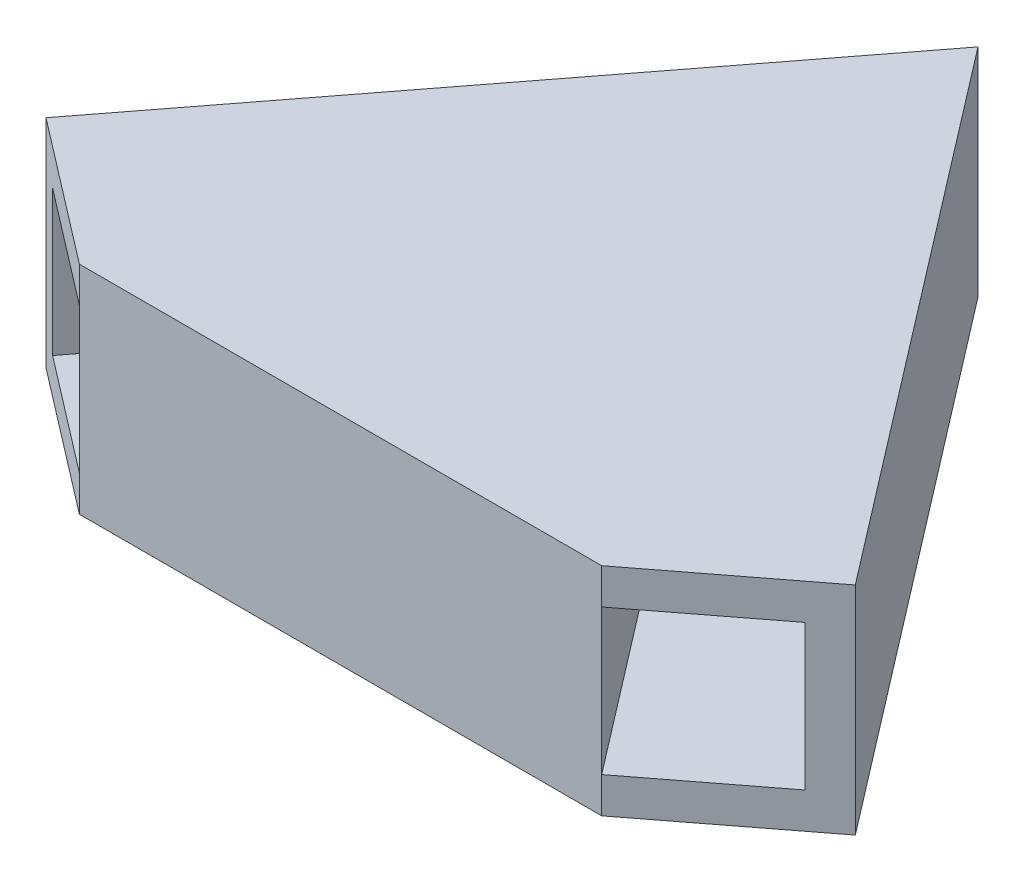
from build123d import *

# Parameters (mm, degrees)
BOSS_EXTRUDE1_DEPTH = 5
BOSS_EXTRUDE2_DEPTH = 20.3
BOSS_EXTRUDE3_DEPTH = 5
BOSS_EXTRUDE4_DEPTH = 20.3
BOSS_EXTRUDE5_DEPTH = 20.3


with BuildPart() as part:
    # Sketch2 → Boss-Extrude1 (new body)
    with BuildSketch(Plane(origin=(0, 0, 0), x_dir=(1, 0, 0), z_dir=(0, 1, 0))):
        Polygon((-56.59752525, -32.199536264), (0, 41.559794682), (0, -47.601200417), (-36.525685741, -47.601200417), align=None)
    boss_extrude1 = extrude(amount=BOSS_EXTRUDE1_DEPTH)

    # Sketch4 → Boss-Extrude2 (add)
    with BuildSketch(Plane(origin=(0, 5, 0), x_dir=(1, 0, 0), z_dir=(0, 1, 0))):
        Polygon((-56.59752525, -32.199536264), (-52.630758548, -35.243343409), (0, 33.346396524), (0, 41.559794682), align=None)
    boss_extrude2 = extrude(amount=BOSS_EXTRUDE2_DEPTH)

    # Sketch5 → Boss-Extrude3 (add)
    with BuildSketch(Plane(origin=(0, 25.3, 0), x_dir=(1, 0, 0), z_dir=(0, 1, 0))):
        Polygon((-56.59752525, -32.199536264), (-36.525685741, -47.601200417), (0, -47.601200417), (0, 41.559794682), align=None)
    boss_extrude3 = extrude(amount=BOSS_EXTRUDE3_DEPTH)

    # Sketch6 → Boss-Extrude4 (add)
    with BuildSketch(Plane(origin=(0, 5, 0), x_dir=(1, 0, 0), z_dir=(0, 1, 0))):
        Polygon((-17.031549002, 11.150449726), (0, -1.91831747), (0, 33.346396524), align=None)
    boss_extrude4 = extrude(amount=BOSS_EXTRUDE4_DEPTH)

    # Sketch7 → Boss-Extrude5 (add)
    with BuildSketch(Plane(origin=(0, 5, 0), x_dir=(1, 0, 0), z_dir=(0, 1, 0))):
        Polygon((-36.525685741, -47.601200417), (-0.926476194, -1.207407283), (0, -1.91831747), (0, -47.601200417), align=None)
    boss_extrude5 = extrude(amount=BOSS_EXTRUDE5_DEPTH)

    # Mirror2: Boss-Extrude1, Boss-Extrude2, Boss-Extrude3, Boss-Extrude4, Boss-Extrude5 across plane
    add(boss_extrude1.mirror(Plane(origin=(0, 5, -41.559794682), x_dir=(0, 0, 1), z_dir=(-1, 0, 0))))
    add(boss_extrude2.mirror(Plane(origin=(0, 5, -41.559794682), x_dir=(0, 0, 1), z_dir=(-1, 0, 0))))
    add(boss_extrude3.mirror(Plane(origin=(0, 5, -41.559794682), x_dir=(0, 0, 1), z_dir=(-1, 0, 0))))
    add(boss_extrude4.mirror(Plane(origin=(0, 5, -41.559794682), x_dir=(0, 0, 1), z_dir=(-1, 0, 0))))
    add(boss_extrude5.mirror(Plane(origin=(0, 5, -41.559794682), x_dir=(0, 0, 1), z_dir=(-1, 0, 0))))


solid = part.part
